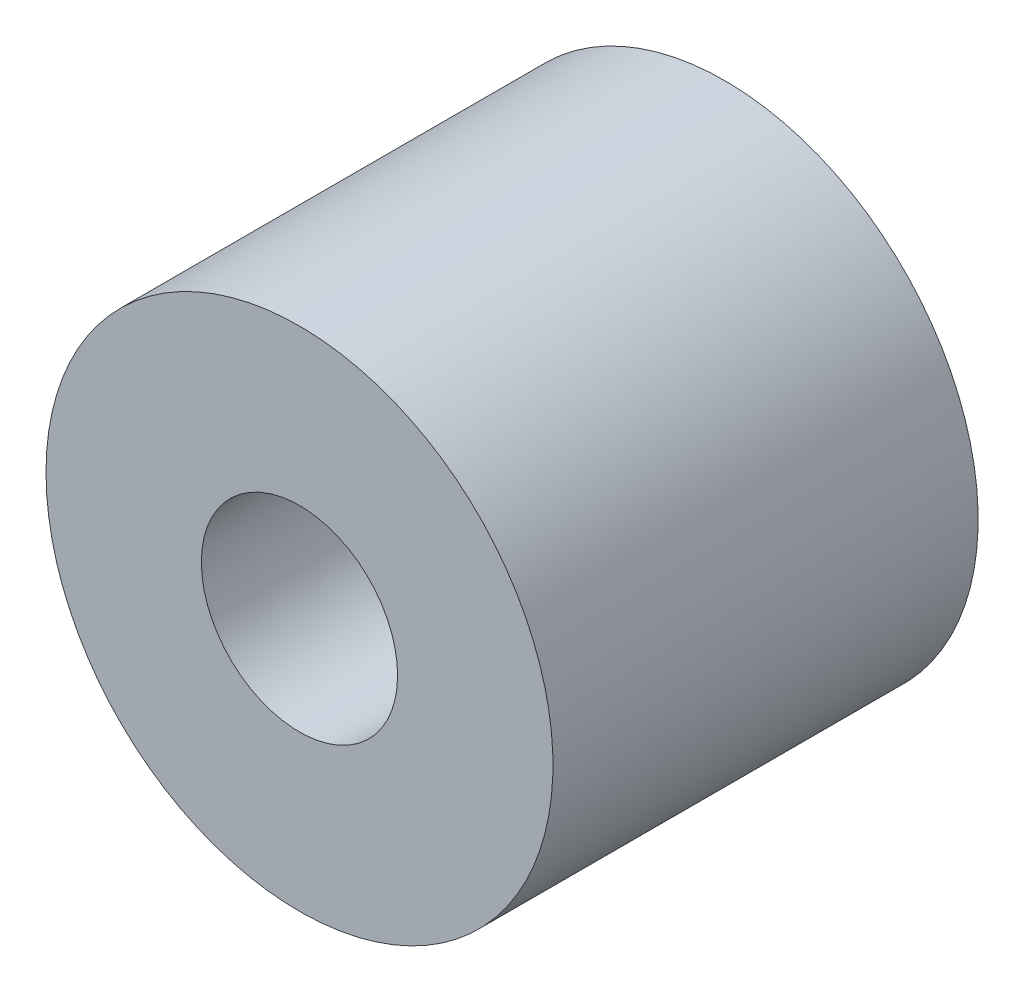
from build123d import *

# Parameters (mm, degrees)
SKETCH_1_R      = 7.75
SKETCH_1_R_2    = 3
EXTRUDE_1_DEPTH = 13


with BuildPart() as part:
    # 草图1 → 凸台-拉伸1 (new body)
    with BuildSketch(Plane.XY):
        with Locations(Location((0, 0, 0), (0, 0, 180))):
            Circle(SKETCH_1_R)
        with Locations(Location((0, 0, 0), (0, 0, 180))):
            Circle(SKETCH_1_R_2, mode=Mode.SUBTRACT)
    extrude(amount=EXTRUDE_1_DEPTH)


solid = part.part
